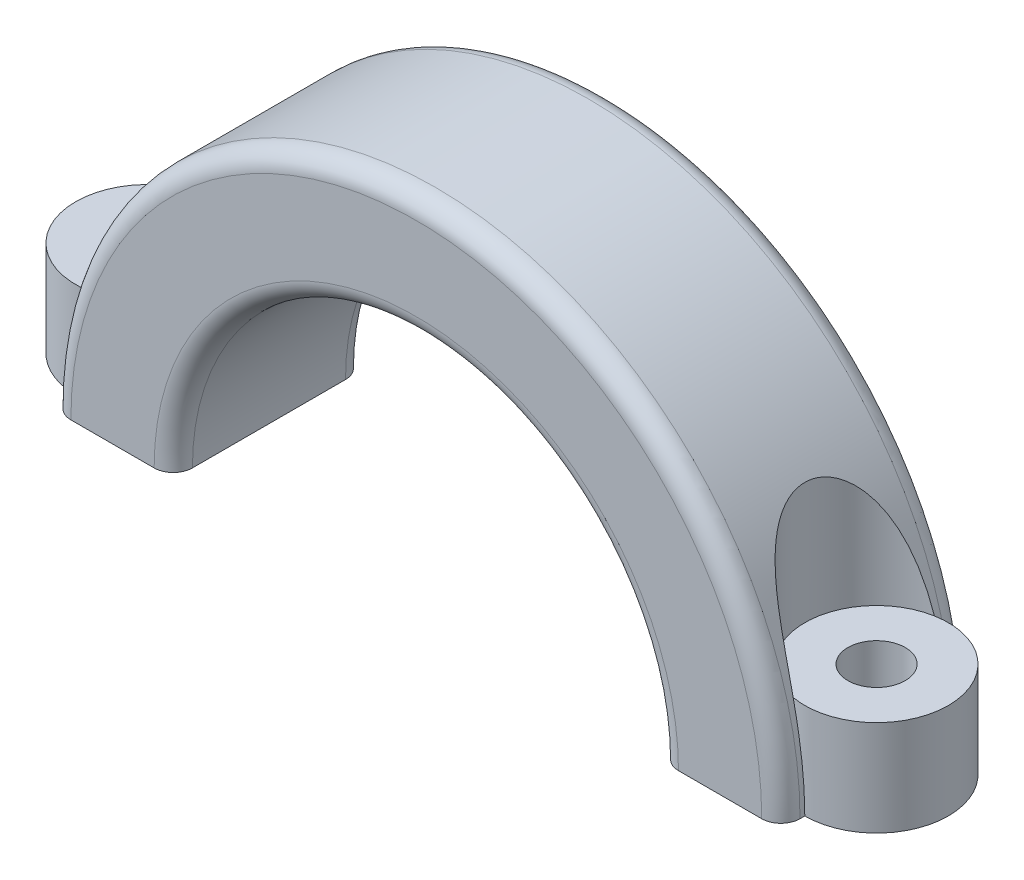
from build123d import *

# Parameters (mm, degrees)
BOSS_EXTRUDE1_DEPTH = 10
SKETCH3_R           = 7.5
BOSS_EXTRUDE2_DEPTH = 10
SKETCH4_R           = 3
CUT_EXTRUDE1_DEPTH  = 61.257530805
SKETCH5_R           = 7.5
CUT_EXTRUDE2_DEPTH  = 55.488255769
FILLET1_R           = 2


with BuildPart() as part:
    # Sketch1 → Boss-Extrude1 (new, symmetric)
    with BuildSketch(Plane.XY):
        with BuildLine():
            Line((-38.1, 0), (-25.4, 0))
            ThreePointArc((-25.4, 0), (0, 25.4), (25.4, 0))
            Line((25.4, 0), (38.1, 0))
            ThreePointArc((38.1, 0), (0, 38.1), (-38.1, 0))
        make_face()
    extrude(amount=BOSS_EXTRUDE1_DEPTH, both=True)

    # Sketch3 → Boss-Extrude2 (add)
    with BuildSketch(Plane.XZ):
        with Locations((38.1, 0)):
            Circle(SKETCH3_R)
    boss_extrude2 = extrude(amount=-BOSS_EXTRUDE2_DEPTH)

    # Sketch4 → Cut-Extrude1 (cut, through all)
    with BuildSketch(Plane.XZ):
        with Locations(Location((38.1, 0, 0), (0, 0, 270))):
            Circle(SKETCH4_R)
    cut_extrude1 = extrude(amount=-CUT_EXTRUDE1_DEPTH, mode=Mode.SUBTRACT)

    # Sketch5 → Cut-Extrude2 (cut, through all)
    with BuildSketch(Plane(origin=(0, 10, 0), x_dir=(1, 0, 0), z_dir=(0, 1, 0))):
        with Locations((38.1, 0)):
            Circle(SKETCH5_R)
    cut_extrude2 = extrude(amount=CUT_EXTRUDE2_DEPTH, mode=Mode.SUBTRACT)

    # Mirror1: Boss-Extrude2, Cut-Extrude1, Cut-Extrude2 across plane
    add(boss_extrude2.mirror(Plane(origin=(0, 0, 0), x_dir=(0, 0, 1), z_dir=(1, 0, 0))))
    add(cut_extrude1.mirror(Plane(origin=(0, 0, 0), x_dir=(0, 0, 1), z_dir=(1, 0, 0))), mode=Mode.SUBTRACT)
    add(cut_extrude2.mirror(Plane(origin=(0, 0, 0), x_dir=(0, 0, 1), z_dir=(1, 0, 0))), mode=Mode.SUBTRACT)

    # Fillet1
    fillet1_edges = [part.edges().sort_by_distance(p)[0] for p in [
        (0, 38.1, 10),
        (0, 25.4, 10),
        (0, 38.1, -10),
        (0, 25.4, -10),
    ]]
    fillet(fillet1_edges, radius=FILLET1_R)


solid = part.part
